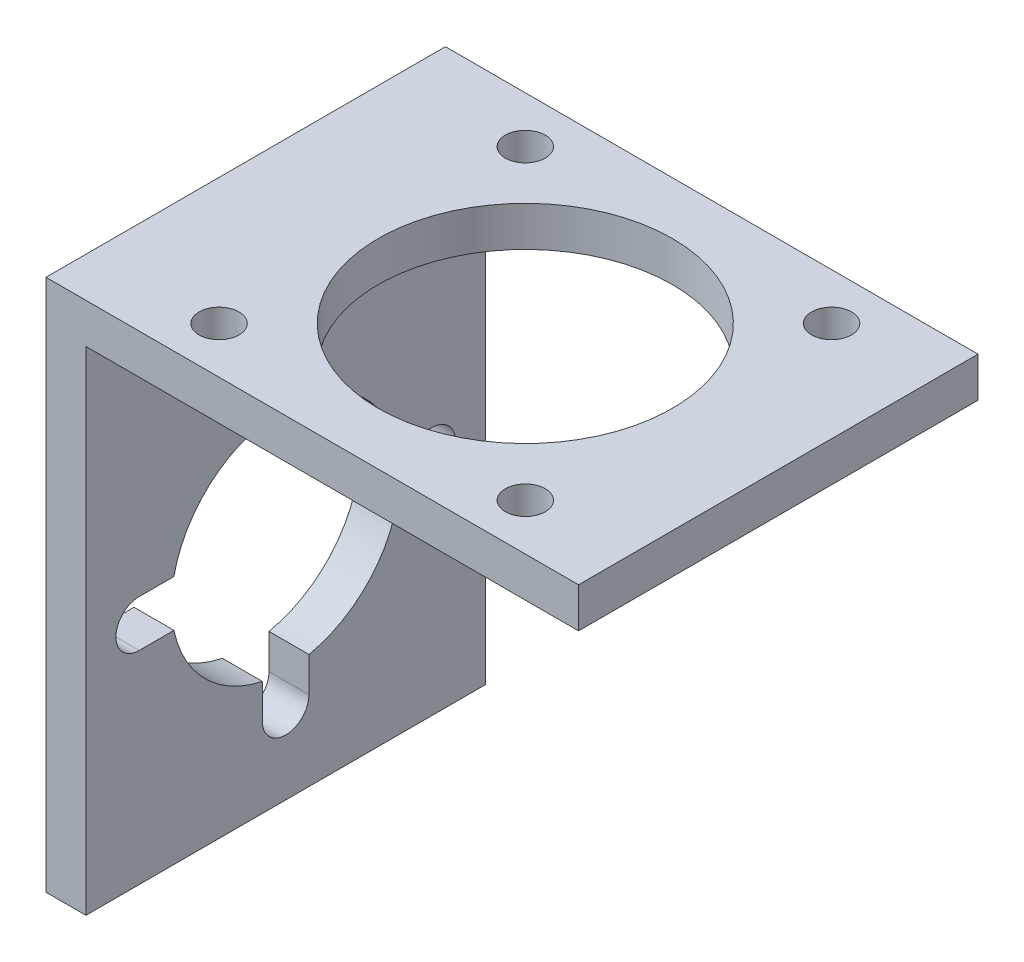
from build123d import *

# Parameters (mm, degrees)
SKETCH1_W             = 40
SKETCH1_H             = 40
BOSS_EXTRUDE1_DEPTH   = 30
SKETCH2_W             = 37
SKETCH2_H             = 37
CUT_EXTRUDE1_DEPTH    = 65.031242374
CUT_EXTRUDE2_DEPTH    = 65.031242374
HOLE1_D               = 22.1
F_3_CLEARANCE_HOLE1_D = 3


with BuildPart() as part:
    # Sketch1 → Boss-Extrude1 (new body)
    with BuildSketch(Plane.XY.offset(30)):
        with Locations((20, -20)):
            Rectangle(SKETCH1_W, SKETCH1_H)
    extrude(amount=-BOSS_EXTRUDE1_DEPTH)

    # Sketch2 → Cut-Extrude1 (cut, through all)
    with BuildSketch(Plane(origin=(0, 0, 0), x_dir=(-1, 0, 0), z_dir=(0, 0, -1))):
        with Locations((-21.5, -21.5)):
            Rectangle(SKETCH2_W, SKETCH2_H)
    extrude(amount=-CUT_EXTRUDE1_DEPTH, mode=Mode.SUBTRACT)

    # Sketch3 → Cut-Extrude2 (cut, through all)
    with BuildSketch(Plane.ZY):
        with BuildLine():
            Line((13.25, -12.02), (13.25, -14.630578089))
            ThreePointArc((13.25, -14.630578089), (8.940094885, -16.960094885), (6.610578089, -21.27))
            Line((6.610578089, -21.27), (4, -21.27))
            ThreePointArc((4, -21.27), (2.25, -23.02), (4, -24.77))
            Line((4, -24.77), (6.610578089, -24.77))
            ThreePointArc((6.610578089, -24.77), (8.940094885, -29.079905115), (13.25, -31.409421911))
            Line((13.25, -31.409421911), (13.25, -34.02))
            ThreePointArc((13.25, -34.02), (15, -35.77), (16.75, -34.02))
            Line((16.75, -34.02), (16.75, -31.409421911))
            ThreePointArc((16.75, -31.409421911), (21.059905115, -29.079905115), (23.389421911, -24.77))
            Line((23.389421911, -24.77), (26, -24.77))
            ThreePointArc((26, -24.77), (27.75, -23.02), (26, -21.27))
            Line((26, -21.27), (23.389421911, -21.27))
            ThreePointArc((23.389421911, -21.27), (21.059905115, -16.960094885), (16.75, -14.630578089))
            Line((16.75, -14.630578089), (16.75, -12.02))
            ThreePointArc((16.75, -12.02), (15, -10.27), (13.25, -12.02))
        make_face()
    extrude(amount=-CUT_EXTRUDE2_DEPTH, mode=Mode.SUBTRACT)

    # Hole1 (through all)
    with Locations(Plane(origin=(0, -3, 0), x_dir=(-1, 0, 0), z_dir=(0, -1, 0))):
        with Locations((-21, -15)):
            Hole(HOLE1_D / 2)

    # #3 Clearance Hole1 (through all)
    with Locations(Plane(origin=(0, -3, 0), x_dir=(-1, 0, 0), z_dir=(0, -1, 0))):
        with Locations((-9.5, -26.502183488), (-9.497816512, -3.5), (-32.5, -3.497816512), (-32.502183488, -26.5)):
            Hole(F_3_CLEARANCE_HOLE1_D / 2)


solid = part.part
